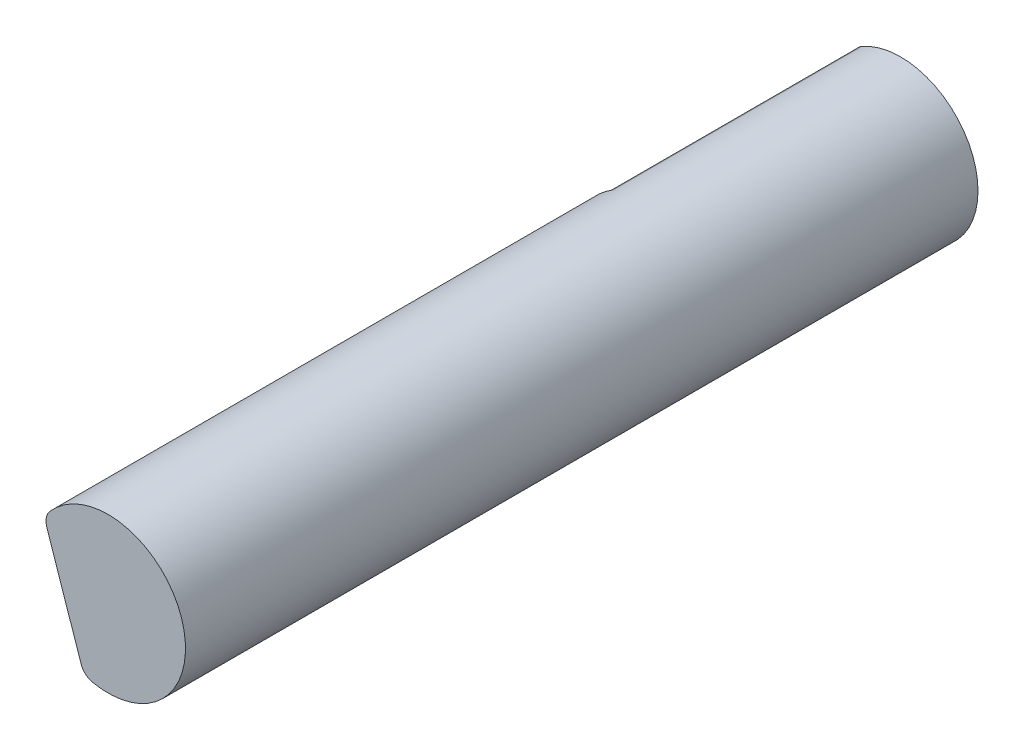
from build123d import *
from build123d.topology import SkipClean

# Parameters (mm, degrees)
SKETCH1_R           = 4.98
BOSS_EXTRUDE1_DEPTH = 50
CUT_EXTRUDE1_DEPTH  = 16
CUT_EXTRUDE2_START  = -16
CUT_EXTRUDE2_DEPTH  = 16
FILLET1_R           = 1
BOSS_EXTRUDE2_START = 1
BOSS_EXTRUDE2_DEPTH = 1


with BuildPart() as part:
    # Sketch1 → Boss-Extrude1 (new body)
    with BuildSketch(Plane.XY):
        Circle(SKETCH1_R)
    extrude(amount=BOSS_EXTRUDE1_DEPTH)

    # Sketch2 → Cut-Extrude1 (cut)
    with BuildSketch(Plane(origin=(0, 0, 0), x_dir=(-1, 0, 0), z_dir=(0, 0, -1))):
        Polygon((3, 37.964295833), (3, 3.974971698), (3, -3.974971698), (3, -37.964295833), (70.97864827, -37.964295833), (70.97864827, 37.964295833), align=None)
    extrude(amount=-CUT_EXTRUDE1_DEPTH, mode=Mode.SUBTRACT)

    # Sketch3 → Cut-Extrude2 (cut)
    with BuildSketch(Plane.XY.offset(50).offset(CUT_EXTRUDE2_START)):
        with BuildLine():
            Line((-1.570261684, -4.725957918), (-4.114243571, 2.805957918))
            ThreePointArc((-4.114243571, 2.805957918), (-4.718139362, -1.5936), (-1.570261684, -4.725957918))
        make_face()
    extrude(amount=CUT_EXTRUDE2_DEPTH, mode=Mode.SUBTRACT)

    # Fillet1
    fillet1_edges = [part.edges().sort_by_distance(p)[0] for p in [
        (-3, 3.974971698, 8),
        (-3, -3.974971698, 8),
        (-4.114243571, 2.805957918, 42),
        (-1.570261684, -4.725957918, 42),
    ]]
    fillet(fillet1_edges, radius=FILLET1_R)

    # Sketch4 → Boss-Extrude2 (add)
    with SkipClean():  # the faces are left unmerged after this step: merging them gives an invalid solid
        with BuildSketch(Plane.XY.offset(50).offset(BOSS_EXTRUDE2_START)):
            with BuildLine():
                Line((-3.943368861, 2.300052613), (-1.741136394, -4.220052613))
                ThreePointArc((-1.741136394, -4.220052613), (-1.455295916, -4.649929795), (-0.993145699, -4.87996533))
                ThreePointArc((-0.993145699, -4.87996533), (4.718139362, 1.5936), (-3.748702906, 3.27835729))
                ThreePointArc((-3.748702906, 3.27835729), (-3.97672335, 2.81520953), (-3.943368861, 2.300052613))
            make_face()
        extrude(amount=-BOSS_EXTRUDE2_DEPTH)


solid = part.part
